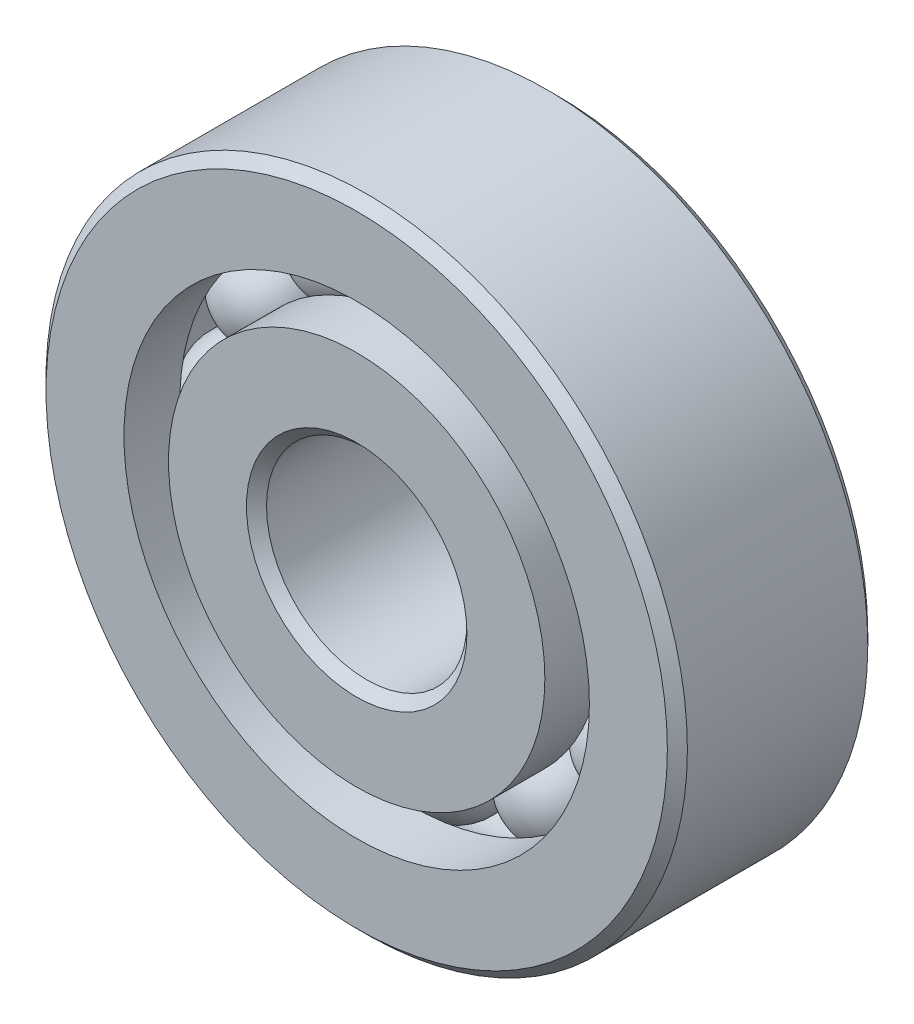
from build123d import *

# Parameters (mm, degrees)
CIRPATTERN1_COUNT = 12


with BuildPart() as part:
    # Sketch2 → Revolve1 (revolve)
    with BuildSketch(Plane(origin=(0, 0, 0), x_dir=(0, 0, -1), z_dir=(1, 0, 0))):
        with BuildLine():
            Line((-2.5, 4.694444444), (-1.111111111, 4.694444444))
            ThreePointArc((-1.111111111, 4.694444444), (0, 4.007740013), (1.111111111, 4.694444444))
            Line((1.111111111, 4.694444444), (2.5, 4.694444444))
            Line((2.5, 4.694444444), (2.5, 2.75))
            Line((2.5, 2.75), (2.25, 2.5))
            Line((2.25, 2.5), (-2.25, 2.5))
            Line((-2.25, 2.5), (-2.5, 2.75))
            Line((-2.5, 2.75), (-2.5, 4.694444444))
        make_face()
        with BuildLine():
            Line((2.25, 8), (2.5, 7.75))
            Line((2.5, 7.75), (2.5, 5.805555556))
            Line((2.5, 5.805555556), (1.111111111, 5.805555556))
            ThreePointArc((1.111111111, 5.805555556), (0, 6.492259987), (-1.111111111, 5.805555556))
            Line((-1.111111111, 5.805555556), (-2.5, 5.805555556))
            Line((-2.5, 5.805555556), (-2.5, 7.75))
            Line((-2.5, 7.75), (-2.25, 8))
            Line((-2.25, 8), (2.25, 8))
        make_face()
    revolve(axis=Axis((0, 0, 2.5), (0, 0, -1)))


with BuildPart() as body_2:
    # Sketch3 → Revolve2 (revolve)
    with BuildSketch(Plane(origin=(0, 0, 0), x_dir=(0, 0, -1), z_dir=(1, 0, 0))):
        with BuildLine():
            Line((-1.242259987, 5.25), (1.242259987, 5.25))
            ThreePointArc((1.242259987, 5.25), (0, 6.492259987), (-1.242259987, 5.25))
        make_face()
    revolve(axis=Axis((0, 5.25, 1.242259987), (0, 0, -1)))


with BuildPart() as cirpattern1_1:
    # CirPattern1: pattern copy
    add(body_2.part.rotate(Axis((0, 0, -2.5), (0, 0, 1)), 1 * 360 / CIRPATTERN1_COUNT))


with BuildPart() as cirpattern1_2:
    # CirPattern1: pattern copy
    add(body_2.part.rotate(Axis((0, 0, -2.5), (0, 0, 1)), 2 * 360 / CIRPATTERN1_COUNT))


with BuildPart() as cirpattern1_3:
    # CirPattern1: pattern copy
    add(body_2.part.rotate(Axis((0, 0, -2.5), (0, 0, 1)), 3 * 360 / CIRPATTERN1_COUNT))


with BuildPart() as cirpattern1_4:
    # CirPattern1: pattern copy
    add(body_2.part.rotate(Axis((0, 0, -2.5), (0, 0, 1)), 4 * 360 / CIRPATTERN1_COUNT))


with BuildPart() as cirpattern1_5:
    # CirPattern1: pattern copy
    add(body_2.part.rotate(Axis((0, 0, -2.5), (0, 0, 1)), 5 * 360 / CIRPATTERN1_COUNT))


with BuildPart() as cirpattern1_6:
    # CirPattern1: pattern copy
    add(body_2.part.rotate(Axis((0, 0, -2.5), (0, 0, 1)), 6 * 360 / CIRPATTERN1_COUNT))


with BuildPart() as cirpattern1_7:
    # CirPattern1: pattern copy
    add(body_2.part.rotate(Axis((0, 0, -2.5), (0, 0, 1)), 7 * 360 / CIRPATTERN1_COUNT))


with BuildPart() as cirpattern1_8:
    # CirPattern1: pattern copy
    add(body_2.part.rotate(Axis((0, 0, -2.5), (0, 0, 1)), 8 * 360 / CIRPATTERN1_COUNT))


with BuildPart() as cirpattern1_9:
    # CirPattern1: pattern copy
    add(body_2.part.rotate(Axis((0, 0, -2.5), (0, 0, 1)), 9 * 360 / CIRPATTERN1_COUNT))


with BuildPart() as cirpattern1_10:
    # CirPattern1: pattern copy
    add(body_2.part.rotate(Axis((0, 0, -2.5), (0, 0, 1)), 10 * 360 / CIRPATTERN1_COUNT))


with BuildPart() as cirpattern1_11:
    # CirPattern1: pattern copy
    add(body_2.part.rotate(Axis((0, 0, -2.5), (0, 0, 1)), 11 * 360 / CIRPATTERN1_COUNT))


solid = Compound([part.part, body_2.part, cirpattern1_1.part, cirpattern1_2.part, cirpattern1_3.part, cirpattern1_4.part, cirpattern1_5.part, cirpattern1_6.part, cirpattern1_7.part, cirpattern1_8.part, cirpattern1_9.part, cirpattern1_10.part, cirpattern1_11.part])
